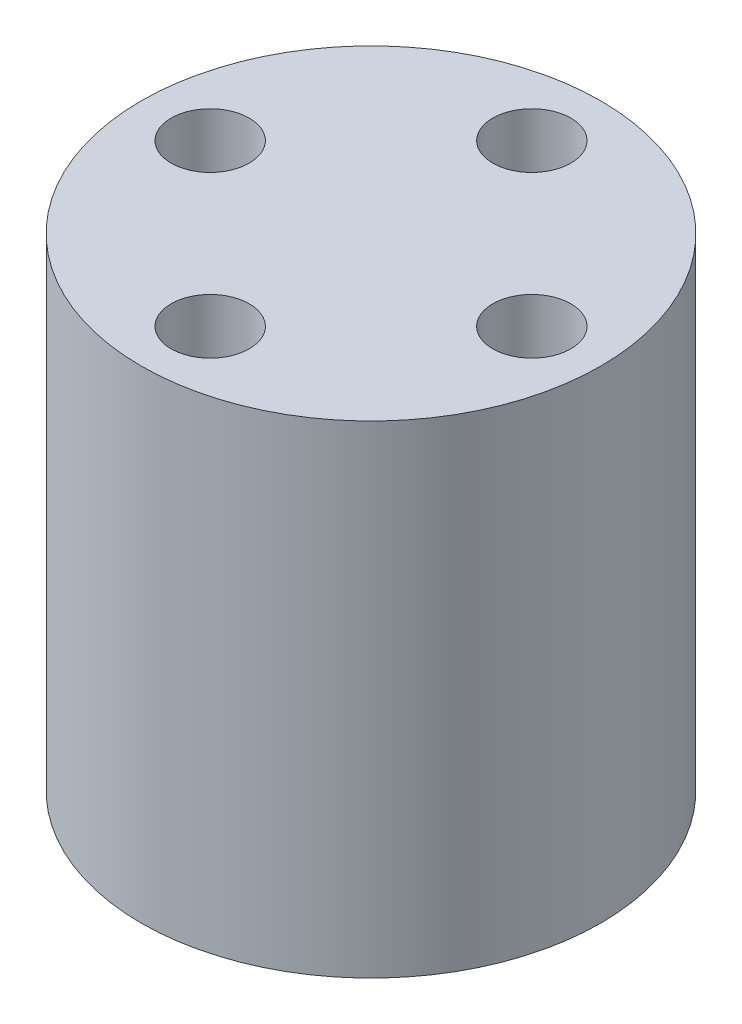
from build123d import *

# Parameters (mm, degrees)
SKETCH_1_R      = 10
SKETCH_1_R_2    = 1.7
EXTRUDE_1_DEPTH = 21


with BuildPart() as part:
    # 草图1 → 凸台-拉伸1 (new body)
    with BuildSketch(Plane(origin=(0, 0, 0), x_dir=(1, 0, 0), z_dir=(0, 1, 0))):
        with Locations(Location((0, 0, 0), (0, 0, 90))):
            Circle(SKETCH_1_R)
        with Locations(Location((0, 7, 0), (0, 0, 90))):
            Circle(SKETCH_1_R_2, mode=Mode.SUBTRACT)
        with Locations(Location((7, 0, 0), (0, 0, 90))):
            Circle(SKETCH_1_R_2, mode=Mode.SUBTRACT)
        with Locations(Location((0, -7, 0), (0, 0, 90))):
            Circle(SKETCH_1_R_2, mode=Mode.SUBTRACT)
        with Locations(Location((-7, 0, 0), (0, 0, 90))):
            Circle(SKETCH_1_R_2, mode=Mode.SUBTRACT)
    extrude(amount=EXTRUDE_1_DEPTH)


solid = part.part
